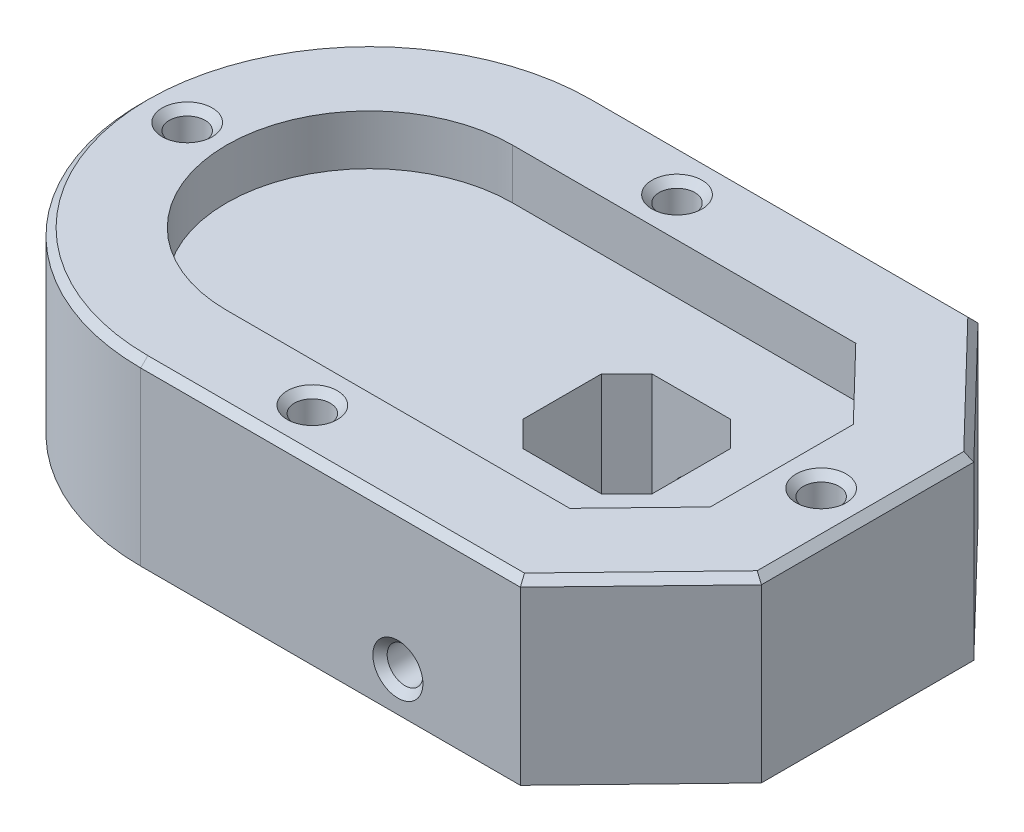
from build123d import *

# Parameters (mm, degrees)
BOSS_EXTRUDE1_DEPTH     = 18
CUT_EXTRUDE1_DEPTH      = 18
EXTRUDE_THIN1_DEPTH     = 25
CUT_EXTRUDE2_DEPTH      = 78.777509214
CUT_EXTRUDE2_DEPTH_BACK = 78.777509214
SKETCH3_R               = 2.5
CHAMFER1_SIZE           = 1
CUT_EXTRUDE3_DEPTH      = 67.100990458
CUT_EXTRUDE3_DEPTH_BACK = 67.100990458
SKETCH6_R               = 2.5
CHAMFER3_SIZE           = 1


with BuildPart() as part:
    # Sketch1 → Boss-Extrude1 (new body)
    with BuildSketch(Plane(origin=(0, 0, 0), x_dir=(1, 0, 0), z_dir=(0, 1, 0))):
        with BuildLine():
            Line((40.156887748, -10), (40.156887748, 10))
            Line((40.156887748, 10), (30.5, 20))
            Line((30.5, 20), (-17.5, 20))
            ThreePointArc((-17.5, 20), (-31.64213568, 14.142135567), (-37.5, -1.6e-07))
            ThreePointArc((-37.5, -1.6e-07), (-31.642135567, -14.14213568), (-17.5, -20))
            Line((-17.5, -20), (30.5, -20))
            Line((30.5, -20), (40.156887748, -10))
        make_face()
    extrude(amount=BOSS_EXTRUDE1_DEPTH)

    # Sketch2 → Cut-Extrude1 (cut)
    with BuildSketch(Plane.XZ):
        Polygon((27.5, 5.5), (27.5, -5.5), (23.964466094, -9.035533906), (12.964466094, -9.035533906), (9.428932188, -5.5), (9.428932188, 5.5), (12.964466094, 9.035533906), (23.964466094, 9.035533906), align=None)
    extrude(amount=-CUT_EXTRUDE1_DEPTH, mode=Mode.SUBTRACT)

    # Sketch4 → Extrude-Thin1 (add)
    with BuildSketch(Plane.XZ):
        with BuildLine():
            Line((-17.5, -32), (35.593697795, -32))
            Line((35.593697795, -32), (52.156887748, -14.84831471))
            Line((52.156887748, -14.84831471), (52.156887748, 14.84831471))
            Line((52.156887748, 14.84831471), (35.593697795, 32))
            Line((35.593697795, 32), (-17.5, 32))
            ThreePointArc((-17.5, 32), (-49.5, 0), (-17.5, -32))
        make_face()
        with BuildLine():
            Line((-17.5, -20), (30.5, -20))
            Line((30.5, -20), (40.156887748, -10))
            Line((40.156887748, -10), (40.156887748, 10))
            Line((40.156887748, 10), (30.5, 20))
            Line((30.5, 20), (-17.5, 20))
            ThreePointArc((-17.5, 20), (-37.5, 0), (-17.5, -20))
        make_face(mode=Mode.SUBTRACT)
    extrude(amount=-EXTRUDE_THIN1_DEPTH)

    # Sketch3 → Cut-Extrude2 (cut, two sides: drawn at the far end of the back side and taken through both)
    with BuildSketch(Plane.XY.offset(20).offset(-CUT_EXTRUDE2_DEPTH_BACK)):
        with Locations((18.464466094, 5.5)):
            Circle(SKETCH3_R)
    extrude(amount=CUT_EXTRUDE2_DEPTH + CUT_EXTRUDE2_DEPTH_BACK, mode=Mode.SUBTRACT)

    # Chamfer1
    chamfer1_edges = [part.edges().sort_by_distance(p)[0] for p in [
        (-49.5, 25, 0),
        (9.046848897, 25, 32),
        (43.875292771, 25, 23.424157355),
        (52.156887748, 25, 0),
        (43.875292771, 25, -23.424157355),
        (9.046848897, 25, -32),
        (15.964466094, 5.5, -32),
        (15.964466094, 5.5, 32),
    ]]
    chamfer(chamfer1_edges, length=CHAMFER1_SIZE)

    # Sketch6 → Cut-Extrude3 (cut, two sides: drawn at the far end of the back side and taken through both)
    with BuildSketch(Plane(origin=(0, 25, 0), x_dir=(1, 0, 0), z_dir=(0, 1, 0)).offset(-CUT_EXTRUDE3_DEPTH_BACK)):
        with Locations(Location((0, 25.5, 0), (0, 0, 270))):
            Circle(SKETCH6_R)
        with Locations(Location((0, -25.5, 0), (0, 0, 270))):
            Circle(SKETCH6_R)
        with Locations(Location((45.656887748, 0, 0), (0, 0, 270))):
            Circle(SKETCH6_R)
        with Locations(Location((-43, 0, 0), (0, 0, 270))):
            Circle(SKETCH6_R)
    extrude(amount=CUT_EXTRUDE3_DEPTH + CUT_EXTRUDE3_DEPTH_BACK, mode=Mode.SUBTRACT)

    # Chamfer3
    chamfer3_edges = [part.edges().sort_by_distance(p)[0] for p in [
        (0, 25, -28),
        (0, 25, 23),
        (45.656887748, 25, -2.5),
        (-43, 25, -2.5),
    ]]
    chamfer(chamfer3_edges, length=CHAMFER3_SIZE)


solid = part.part
